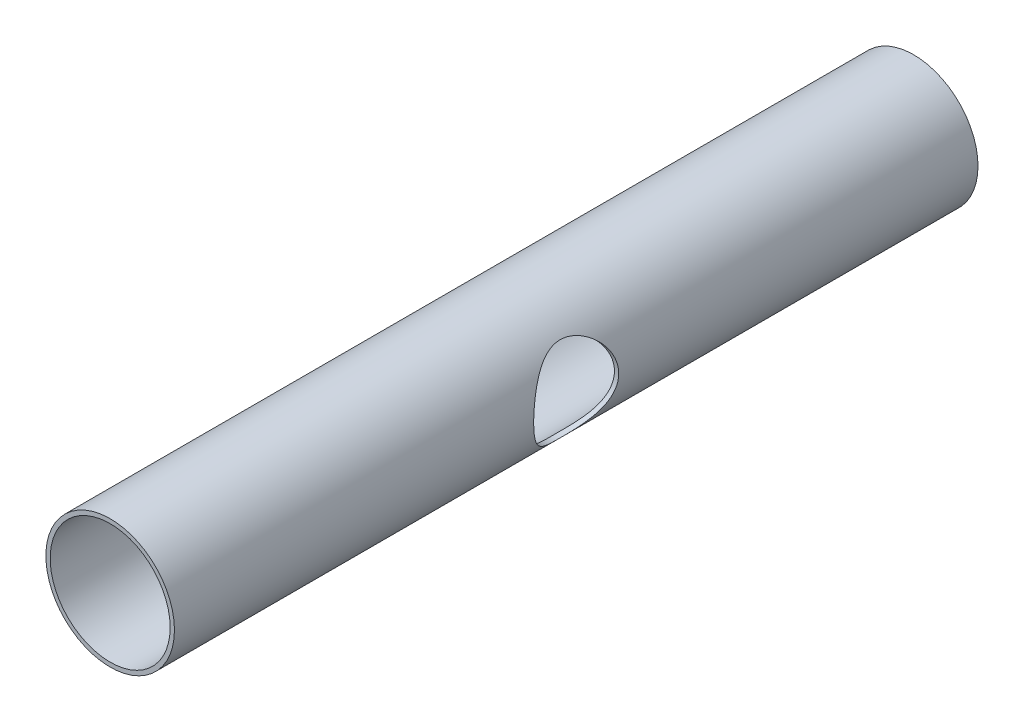
from build123d import *

# Parameters (mm, degrees)
SKETCH1_R               = 12
SKETCH1_R_2             = 11.2
BOSS_EXTRUDE1_DEPTH     = 75
CUT_EXTRUDE1_DEPTH      = 77.896033708
CUT_EXTRUDE1_DEPTH_BACK = 77.896033708
SKETCH2_R               = 7.9375


with BuildPart() as part:
    # Sketch1 → Boss-Extrude1 (new, symmetric)
    with BuildSketch(Plane.XY):
        Circle(SKETCH1_R)
        Circle(SKETCH1_R_2, mode=Mode.SUBTRACT)
    extrude(amount=BOSS_EXTRUDE1_DEPTH, both=True)

    # Sketch2 → Cut-Extrude1 (cut, two sides: drawn at the far end of the back side and taken through both)
    with BuildSketch(Plane(origin=(0, 0, 0), x_dir=(0, 0, -1), z_dir=(1, 0, 0)).offset(-CUT_EXTRUDE1_DEPTH_BACK)):
        Circle(SKETCH2_R)
    extrude(amount=CUT_EXTRUDE1_DEPTH + CUT_EXTRUDE1_DEPTH_BACK, mode=Mode.SUBTRACT)


solid = part.part
